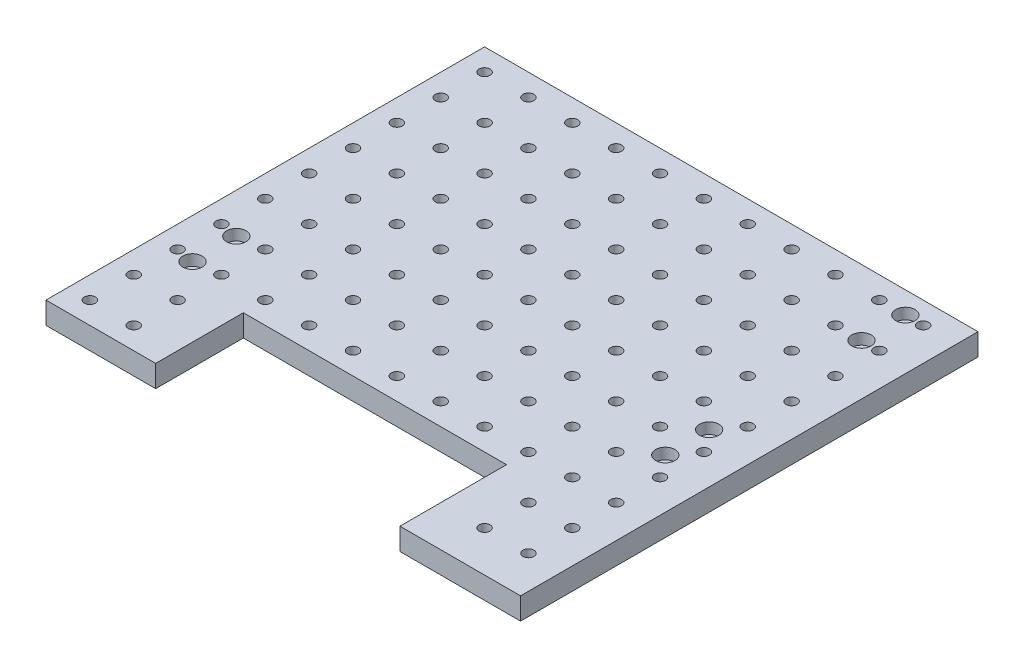
from build123d import *

# Parameters (mm, degrees)
SKETCH1_R           = 3.175
BOSS_EXTRUDE1_DEPTH = 12.7
SKETCH2_R           = 3.429
CUT_EXTRUDE1_DEPTH  = 12.7
SKETCH2_3_R         = 5.588
SKETCH2_3_R_2       = 3.429
CUT_EXTRUDE2_DEPTH  = 6.35
SKETCH2_4_R         = 3.429
CUT_EXTRUDE3_DEPTH  = 12.7
SKETCH2_5_R         = 5.588
SKETCH2_5_R_2       = 3.429
CUT_EXTRUDE4_DEPTH  = 6.35


with BuildPart() as part:
    # Sketch1 → Boss-Extrude1 (new body)
    with BuildSketch(Plane(origin=(0, 0, 0), x_dir=(1, 0, 0), z_dir=(0, 1, 0))):
        Polygon((63.5, 0), (215.9, 0), (215.9, -61.722), (285.75, -61.722), (285.75, 0), (285.75, 203.2), (0, 203.2), (0, 0), (0, -50.8), (63.5, -50.8), align=None)
        with Locations((12.7, 190.5)):
            Circle(SKETCH1_R, mode=Mode.SUBTRACT)
        with Locations((38.1, 190.5)):
            Circle(SKETCH1_R, mode=Mode.SUBTRACT)
        with Locations((63.5, 190.5)):
            Circle(SKETCH1_R, mode=Mode.SUBTRACT)
        with Locations((88.9, 190.5)):
            Circle(SKETCH1_R, mode=Mode.SUBTRACT)
        with Locations((114.3, 190.5)):
            Circle(SKETCH1_R, mode=Mode.SUBTRACT)
        with Locations((139.7, 190.5)):
            Circle(SKETCH1_R, mode=Mode.SUBTRACT)
        with Locations((165.1, 190.5)):
            Circle(SKETCH1_R, mode=Mode.SUBTRACT)
        with Locations((190.5, 190.5)):
            Circle(SKETCH1_R, mode=Mode.SUBTRACT)
        with Locations((215.9, 190.5)):
            Circle(SKETCH1_R, mode=Mode.SUBTRACT)
        with Locations((241.3, 190.5)):
            Circle(SKETCH1_R, mode=Mode.SUBTRACT)
        with Locations((266.7, 190.5)):
            Circle(SKETCH1_R, mode=Mode.SUBTRACT)
        with Locations((38.1, 165.1)):
            Circle(SKETCH1_R, mode=Mode.SUBTRACT)
        with Locations((63.5, 165.1)):
            Circle(SKETCH1_R, mode=Mode.SUBTRACT)
        with Locations((88.9, 165.1)):
            Circle(SKETCH1_R, mode=Mode.SUBTRACT)
        with Locations((114.3, 165.1)):
            Circle(SKETCH1_R, mode=Mode.SUBTRACT)
        with Locations((139.7, 165.1)):
            Circle(SKETCH1_R, mode=Mode.SUBTRACT)
        with Locations((165.1, 165.1)):
            Circle(SKETCH1_R, mode=Mode.SUBTRACT)
        with Locations((190.5, 165.1)):
            Circle(SKETCH1_R, mode=Mode.SUBTRACT)
        with Locations((215.9, 165.1)):
            Circle(SKETCH1_R, mode=Mode.SUBTRACT)
        with Locations((241.3, 165.1)):
            Circle(SKETCH1_R, mode=Mode.SUBTRACT)
        with Locations((266.7, 165.1)):
            Circle(SKETCH1_R, mode=Mode.SUBTRACT)
        with Locations((38.1, 139.7)):
            Circle(SKETCH1_R, mode=Mode.SUBTRACT)
        with Locations((63.5, 139.7)):
            Circle(SKETCH1_R, mode=Mode.SUBTRACT)
        with Locations((88.9, 139.7)):
            Circle(SKETCH1_R, mode=Mode.SUBTRACT)
        with Locations((114.3, 139.7)):
            Circle(SKETCH1_R, mode=Mode.SUBTRACT)
        with Locations((139.7, 139.7)):
            Circle(SKETCH1_R, mode=Mode.SUBTRACT)
        with Locations((165.1, 139.7)):
            Circle(SKETCH1_R, mode=Mode.SUBTRACT)
        with Locations((190.5, 139.7)):
            Circle(SKETCH1_R, mode=Mode.SUBTRACT)
        with Locations((215.9, 139.7)):
            Circle(SKETCH1_R, mode=Mode.SUBTRACT)
        with Locations((241.3, 139.7)):
            Circle(SKETCH1_R, mode=Mode.SUBTRACT)
        with Locations((266.7, 139.7)):
            Circle(SKETCH1_R, mode=Mode.SUBTRACT)
        with Locations((38.1, 114.3)):
            Circle(SKETCH1_R, mode=Mode.SUBTRACT)
        with Locations((63.5, 114.3)):
            Circle(SKETCH1_R, mode=Mode.SUBTRACT)
        with Locations((88.9, 114.3)):
            Circle(SKETCH1_R, mode=Mode.SUBTRACT)
        with Locations((114.3, 114.3)):
            Circle(SKETCH1_R, mode=Mode.SUBTRACT)
        with Locations((139.7, 114.3)):
            Circle(SKETCH1_R, mode=Mode.SUBTRACT)
        with Locations((165.1, 114.3)):
            Circle(SKETCH1_R, mode=Mode.SUBTRACT)
        with Locations((190.5, 114.3)):
            Circle(SKETCH1_R, mode=Mode.SUBTRACT)
        with Locations((215.9, 114.3)):
            Circle(SKETCH1_R, mode=Mode.SUBTRACT)
        with Locations((241.3, 114.3)):
            Circle(SKETCH1_R, mode=Mode.SUBTRACT)
        with Locations((266.7, 114.3)):
            Circle(SKETCH1_R, mode=Mode.SUBTRACT)
        with Locations((38.1, 88.9)):
            Circle(SKETCH1_R, mode=Mode.SUBTRACT)
        with Locations((63.5, 88.9)):
            Circle(SKETCH1_R, mode=Mode.SUBTRACT)
        with Locations((88.9, 88.9)):
            Circle(SKETCH1_R, mode=Mode.SUBTRACT)
        with Locations((114.3, 88.9)):
            Circle(SKETCH1_R, mode=Mode.SUBTRACT)
        with Locations((139.7, 88.9)):
            Circle(SKETCH1_R, mode=Mode.SUBTRACT)
        with Locations((165.1, 88.9)):
            Circle(SKETCH1_R, mode=Mode.SUBTRACT)
        with Locations((190.5, 88.9)):
            Circle(SKETCH1_R, mode=Mode.SUBTRACT)
        with Locations((215.9, 88.9)):
            Circle(SKETCH1_R, mode=Mode.SUBTRACT)
        with Locations((241.3, 88.9)):
            Circle(SKETCH1_R, mode=Mode.SUBTRACT)
        with Locations((266.7, 88.9)):
            Circle(SKETCH1_R, mode=Mode.SUBTRACT)
        with Locations((38.1, 63.5)):
            Circle(SKETCH1_R, mode=Mode.SUBTRACT)
        with Locations((63.5, 63.5)):
            Circle(SKETCH1_R, mode=Mode.SUBTRACT)
        with Locations((88.9, 63.5)):
            Circle(SKETCH1_R, mode=Mode.SUBTRACT)
        with Locations((114.3, 63.5)):
            Circle(SKETCH1_R, mode=Mode.SUBTRACT)
        with Locations((139.7, 63.5)):
            Circle(SKETCH1_R, mode=Mode.SUBTRACT)
        with Locations((165.1, 63.5)):
            Circle(SKETCH1_R, mode=Mode.SUBTRACT)
        with Locations((190.5, 63.5)):
            Circle(SKETCH1_R, mode=Mode.SUBTRACT)
        with Locations((215.9, 63.5)):
            Circle(SKETCH1_R, mode=Mode.SUBTRACT)
        with Locations((241.3, 63.5)):
            Circle(SKETCH1_R, mode=Mode.SUBTRACT)
        with Locations((266.7, 63.5)):
            Circle(SKETCH1_R, mode=Mode.SUBTRACT)
        with Locations((38.1, 38.1)):
            Circle(SKETCH1_R, mode=Mode.SUBTRACT)
        with Locations((63.5, 38.1)):
            Circle(SKETCH1_R, mode=Mode.SUBTRACT)
        with Locations((88.9, 38.1)):
            Circle(SKETCH1_R, mode=Mode.SUBTRACT)
        with Locations((114.3, 38.1)):
            Circle(SKETCH1_R, mode=Mode.SUBTRACT)
        with Locations((139.7, 38.1)):
            Circle(SKETCH1_R, mode=Mode.SUBTRACT)
        with Locations((165.1, 38.1)):
            Circle(SKETCH1_R, mode=Mode.SUBTRACT)
        with Locations((190.5, 38.1)):
            Circle(SKETCH1_R, mode=Mode.SUBTRACT)
        with Locations((215.9, 38.1)):
            Circle(SKETCH1_R, mode=Mode.SUBTRACT)
        with Locations((241.3, 38.1)):
            Circle(SKETCH1_R, mode=Mode.SUBTRACT)
        with Locations((266.7, 38.1)):
            Circle(SKETCH1_R, mode=Mode.SUBTRACT)
        with Locations((38.1, 12.7)):
            Circle(SKETCH1_R, mode=Mode.SUBTRACT)
        with Locations((63.5, 12.7)):
            Circle(SKETCH1_R, mode=Mode.SUBTRACT)
        with Locations((88.9, 12.7)):
            Circle(SKETCH1_R, mode=Mode.SUBTRACT)
        with Locations((114.3, 12.7)):
            Circle(SKETCH1_R, mode=Mode.SUBTRACT)
        with Locations((139.7, 12.7)):
            Circle(SKETCH1_R, mode=Mode.SUBTRACT)
        with Locations((165.1, 12.7)):
            Circle(SKETCH1_R, mode=Mode.SUBTRACT)
        with Locations((190.5, 12.7)):
            Circle(SKETCH1_R, mode=Mode.SUBTRACT)
        with Locations((215.9, 12.7)):
            Circle(SKETCH1_R, mode=Mode.SUBTRACT)
        with Locations((241.3, 12.7)):
            Circle(SKETCH1_R, mode=Mode.SUBTRACT)
        with Locations((266.7, 12.7)):
            Circle(SKETCH1_R, mode=Mode.SUBTRACT)
        with Locations((38.1, -12.7)):
            Circle(SKETCH1_R, mode=Mode.SUBTRACT)
        with Locations((241.3, -12.7)):
            Circle(SKETCH1_R, mode=Mode.SUBTRACT)
        with Locations((266.7, -12.7)):
            Circle(SKETCH1_R, mode=Mode.SUBTRACT)
        with Locations((38.1, -38.1)):
            Circle(SKETCH1_R, mode=Mode.SUBTRACT)
        with Locations((241.3, -38.1)):
            Circle(SKETCH1_R, mode=Mode.SUBTRACT)
        with Locations((266.7, -38.1)):
            Circle(SKETCH1_R, mode=Mode.SUBTRACT)
        with Locations((12.7, 165.1)):
            Circle(SKETCH1_R, mode=Mode.SUBTRACT)
        with Locations((12.7, 139.7)):
            Circle(SKETCH1_R, mode=Mode.SUBTRACT)
        with Locations((12.7, 114.3)):
            Circle(SKETCH1_R, mode=Mode.SUBTRACT)
        with Locations((12.7, 88.9)):
            Circle(SKETCH1_R, mode=Mode.SUBTRACT)
        with Locations((12.7, 63.5)):
            Circle(SKETCH1_R, mode=Mode.SUBTRACT)
        with Locations((12.7, 38.1)):
            Circle(SKETCH1_R, mode=Mode.SUBTRACT)
        with Locations((12.7, 12.7)):
            Circle(SKETCH1_R, mode=Mode.SUBTRACT)
        with Locations((12.7, -12.7)):
            Circle(SKETCH1_R, mode=Mode.SUBTRACT)
        with Locations((12.7, -38.1)):
            Circle(SKETCH1_R, mode=Mode.SUBTRACT)
    extrude(amount=BOSS_EXTRUDE1_DEPTH)

    # Sketch2 → Cut-Extrude1 (cut)
    with BuildSketch(Plane(origin=(0, 12.7, 0), x_dir=(1, 0, 0), z_dir=(0, 1, 0))):
        with Locations((256.371737876, 190.5)):
            Circle(SKETCH2_R)
        with Locations((256.371737876, 165.1)):
            Circle(SKETCH2_R)
        with Locations((257.048, 76.2)):
            Circle(SKETCH2_R)
        with Locations((257.048, 50.8)):
            Circle(SKETCH2_R)
    extrude(amount=-CUT_EXTRUDE1_DEPTH, mode=Mode.SUBTRACT)

    # Sketch2<3> → Cut-Extrude2 (cut)
    # profile 1 of 4: a face of its own
    with BuildSketch(Plane(origin=(0, 12.7, 0), x_dir=(1, 0, 0), z_dir=(0, 1, 0))):
        with Locations((256.371737876, 190.5)):
            Circle(SKETCH2_3_R)
        with Locations((256.371737876, 190.5)):
            Circle(SKETCH2_3_R_2, mode=Mode.SUBTRACT)
    # profile 2 of 4: a face of its own
    with BuildSketch(Plane(origin=(0, 12.7, 0), x_dir=(1, 0, 0), z_dir=(0, 1, 0))):
        with Locations((256.371737876, 165.1)):
            Circle(SKETCH2_3_R)
        with Locations((256.371737876, 165.1)):
            Circle(SKETCH2_3_R_2, mode=Mode.SUBTRACT)
    # profile 3 of 4: a face of its own
    with BuildSketch(Plane(origin=(0, 12.7, 0), x_dir=(1, 0, 0), z_dir=(0, 1, 0))):
        with Locations((257.048, 76.2)):
            Circle(SKETCH2_3_R)
        with Locations((257.048, 76.2)):
            Circle(SKETCH2_3_R_2, mode=Mode.SUBTRACT)
    # profile 4 of 4: a face of its own
    with BuildSketch(Plane(origin=(0, 12.7, 0), x_dir=(1, 0, 0), z_dir=(0, 1, 0))):
        with Locations((257.048, 50.8)):
            Circle(SKETCH2_3_R)
        with Locations((257.048, 50.8)):
            Circle(SKETCH2_3_R_2, mode=Mode.SUBTRACT)
    extrude(amount=-CUT_EXTRUDE2_DEPTH, mode=Mode.SUBTRACT)

    # Sketch2<4> → Cut-Extrude3 (cut)
    with BuildSketch(Plane(origin=(0, 12.7, 0), x_dir=(1, 0, 0), z_dir=(0, 1, 0))):
        with Locations((23.114, 10.922)):
            Circle(SKETCH2_4_R)
        with Locations((23.114, 36.322)):
            Circle(SKETCH2_4_R)
    extrude(amount=-CUT_EXTRUDE3_DEPTH, mode=Mode.SUBTRACT)

    # Sketch2<5> → Cut-Extrude4 (cut)
    # profile 1 of 2: a face of its own
    with BuildSketch(Plane(origin=(0, 12.7, 0), x_dir=(1, 0, 0), z_dir=(0, 1, 0))):
        with Locations((23.114, 10.922)):
            Circle(SKETCH2_5_R)
        with Locations((23.114, 10.922)):
            Circle(SKETCH2_5_R_2, mode=Mode.SUBTRACT)
    # profile 2 of 2: a face of its own
    with BuildSketch(Plane(origin=(0, 12.7, 0), x_dir=(1, 0, 0), z_dir=(0, 1, 0))):
        with Locations((23.114, 36.322)):
            Circle(SKETCH2_5_R)
        with Locations((23.114, 36.322)):
            Circle(SKETCH2_5_R_2, mode=Mode.SUBTRACT)
    extrude(amount=-CUT_EXTRUDE4_DEPTH, mode=Mode.SUBTRACT)


solid = part.part
